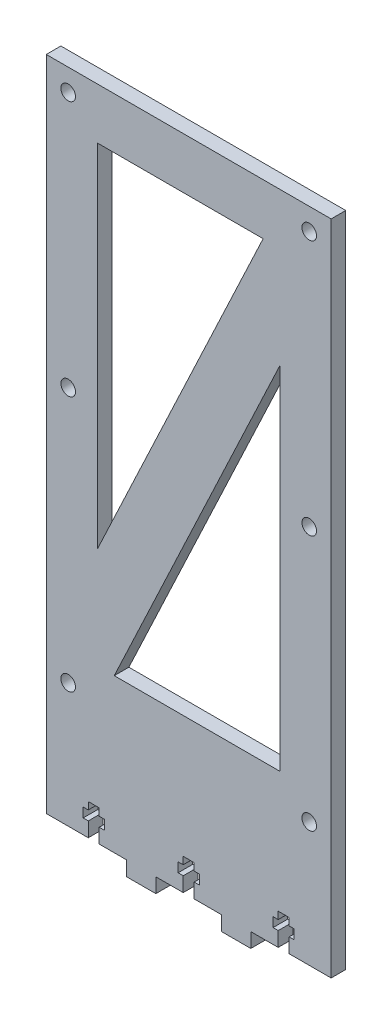
from build123d import *

# Parameters (mm, degrees)
SKETCH_1_W          = 78
SKETCH_1_H          = 180
EXTRUDE_1_DEPTH     = 4
CUT_EXTRUDE_1_DEPTH = 4
SKETCH_6_W          = 8
SKETCH_6_H          = 8
EXTRUDE_2_DEPTH     = 4
SKETCH_7_R          = 2
CUT_EXTRUDE_2_DEPTH = 10


with BuildPart() as part:
    # 草图1 → 凸台-拉伸1 (new body)
    with BuildSketch(Plane.XY):
        with Locations((-4, -57.5)):
            Rectangle(SKETCH_1_W, SKETCH_1_H)
    extrude(amount=EXTRUDE_1_DEPTH)

    # 草图2 → 切除-拉伸1 (cut)
    with BuildSketch(Plane.XY.offset(4)):
        Polygon((-31.5, -147.5), (-31.5, -143.5), (-32.9, -143.5), (-32.9, -140.9), (-31.5, -140.9), (-31.5, -138.9), (-28.5, -138.9), (-28.5, -140.9), (-27.1, -140.9), (-27.1, -143.5), (-28.5, -143.5), (-28.5, -147.5), align=None)
        Polygon((23.5, -147.5), (20.5, -147.5), (20.5, -143.5), (19.1, -143.5), (19.1, -140.9), (20.5, -140.9), (20.5, -138.9), (23.5, -138.9), (23.5, -140.9), (24.9, -140.9), (24.9, -143.5), (23.5, -143.5), align=None)
        Polygon((-5.5, -147.5), (-5.5, -143.5), (-6.9, -143.5), (-6.9, -140.9), (-5.5, -140.9), (-5.5, -138.9), (-2.5, -138.9), (-2.5, -140.9), (-1.1, -140.9), (-1.1, -143.5), (-2.5, -143.5), (-2.5, -147.5), align=None)
    extrude(amount=-CUT_EXTRUDE_1_DEPTH, mode=Mode.SUBTRACT)

    # 草图6 → 凸台-拉伸2 (add)
    with BuildSketch(Plane.XY.offset(4)):
        with Locations((-17, -147.5)):
            Rectangle(SKETCH_6_W, SKETCH_6_H)
        with Locations((9, -147.5)):
            Rectangle(SKETCH_6_W, SKETCH_6_H)
    extrude(amount=-EXTRUDE_2_DEPTH)

    # 草图7 → 切除-拉伸2 (cut)
    with BuildSketch(Plane(origin=(0, 0, 0), x_dir=(-1, 0, 0), z_dir=(0, 0, -1))):
        with Locations((-29, 26.5)):
            Circle(SKETCH_7_R)
        with Locations((-29, -43.5)):
            Circle(SKETCH_7_R)
        with Locations((-29, -113.5)):
            Circle(SKETCH_7_R)
        with Locations((37, -43.5)):
            Circle(SKETCH_7_R)
        with Locations((37, -113.5)):
            Circle(SKETCH_7_R)
        with Locations((37, 26.5)):
            Circle(SKETCH_7_R)
        Polygon((29, 18.5), (-16.384156611, 18.5), (29, -77.769423114), align=None)
        Polygon((-21, -105.5), (-21, -9.230576886), (24.384156611, -105.5), align=None)
    extrude(amount=-CUT_EXTRUDE_2_DEPTH, mode=Mode.SUBTRACT)


solid = part.part
